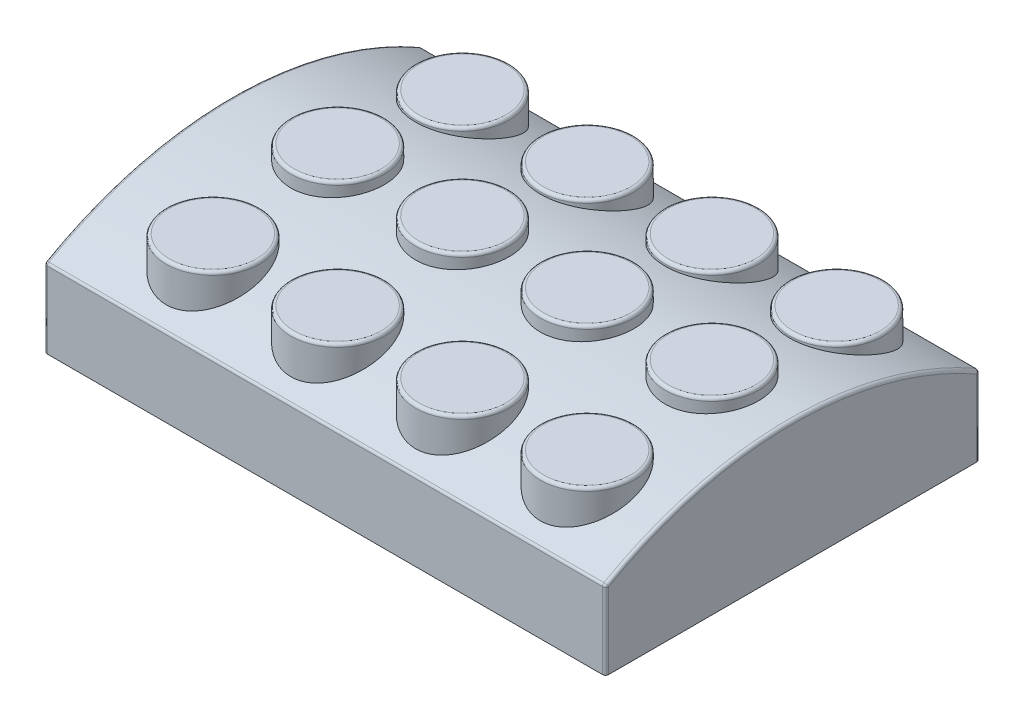
from build123d import *

# Parameters (mm, degrees)
BOSS_EXTRUDE1_DEPTH = 457.2
SKETCH2_R           = 38.1
BOSS_EXTRUDE3_DEPTH = 114.3
SKETCH2_5_R         = 38.1
BOSS_EXTRUDE4_DEPTH = 101.6
FILLET1_R           = 2.54


with BuildPart() as part:
    # Sketch1 → Boss-Extrude1 (new body)
    with BuildSketch(Plane(origin=(0, 0, 0), x_dir=(0, 0, -1), z_dir=(1, 0, 0))):
        with BuildLine():
            Line((0, 0), (304.8, 0))
            Line((304.8, 0), (304.8, 63.5))
            ThreePointArc((304.8, 63.5), (152.4, 104.335456927), (0, 63.5))
            Line((0, 63.5), (0, 0))
        make_face()
    extrude(amount=BOSS_EXTRUDE1_DEPTH)

    # Sketch2 → Boss-Extrude3 (add)
    with BuildSketch(Plane(origin=(0, 0, 0), x_dir=(1, 0, 0), z_dir=(0, 1, 0))):
        with Locations((391.410477658, 152.4)):
            Circle(SKETCH2_R)
        with Locations((289.810477658, 152.4)):
            Circle(SKETCH2_R)
        with Locations((188.210477658, 152.4)):
            Circle(SKETCH2_R)
        with Locations((86.610477658, 152.4)):
            Circle(SKETCH2_R)
    extrude(amount=BOSS_EXTRUDE3_DEPTH)

    # Sketch2<5> → Boss-Extrude4 (add)
    with BuildSketch(Plane(origin=(0, 0, 0), x_dir=(1, 0, 0), z_dir=(0, 1, 0))):
        with Locations((391.410477658, 254)):
            Circle(SKETCH2_5_R)
        with Locations((289.810477658, 254)):
            Circle(SKETCH2_5_R)
        with Locations((188.210477658, 254)):
            Circle(SKETCH2_5_R)
        with Locations((86.610477658, 254)):
            Circle(SKETCH2_5_R)
        with Locations((289.810477658, 50.8)):
            Circle(SKETCH2_5_R)
        with Locations((188.210477658, 50.8)):
            Circle(SKETCH2_5_R)
        with Locations((86.610477658, 50.8)):
            Circle(SKETCH2_5_R)
        with Locations((391.410477658, 50.8)):
            Circle(SKETCH2_5_R)
    extrude(amount=BOSS_EXTRUDE4_DEPTH)

    # Fillet1
    fillet1_edges = [part.edges().sort_by_distance(p)[0] for p in [
        (150.110477658, 101.6, -50.8),
        (251.710477658, 114.3, -152.4),
        (457.2, 31.75, -304.8),
        (457.2, 31.75, 0),
        (0, 31.75, 0),
        (0, 31.75, -304.8),
        (228.6, 63.5, -304.8),
        (457.2, 104.335456927, -152.4),
        (0, 104.335456927, -152.4),
        (228.6, 63.5, 0),
        (48.510477658, 101.6, -50.8),
        (251.710477658, 101.6, -50.8),
        (353.310477658, 101.6, -50.8),
        (48.510477658, 114.3, -152.4),
        (150.110477658, 114.3, -152.4),
        (353.310477658, 114.3, -152.4),
        (353.310477658, 101.6, -254),
        (251.710477658, 101.6, -254),
        (150.110477658, 101.6, -254),
        (48.510477658, 101.6, -254),
    ]]
    fillet(fillet1_edges, radius=FILLET1_R)


solid = part.part
